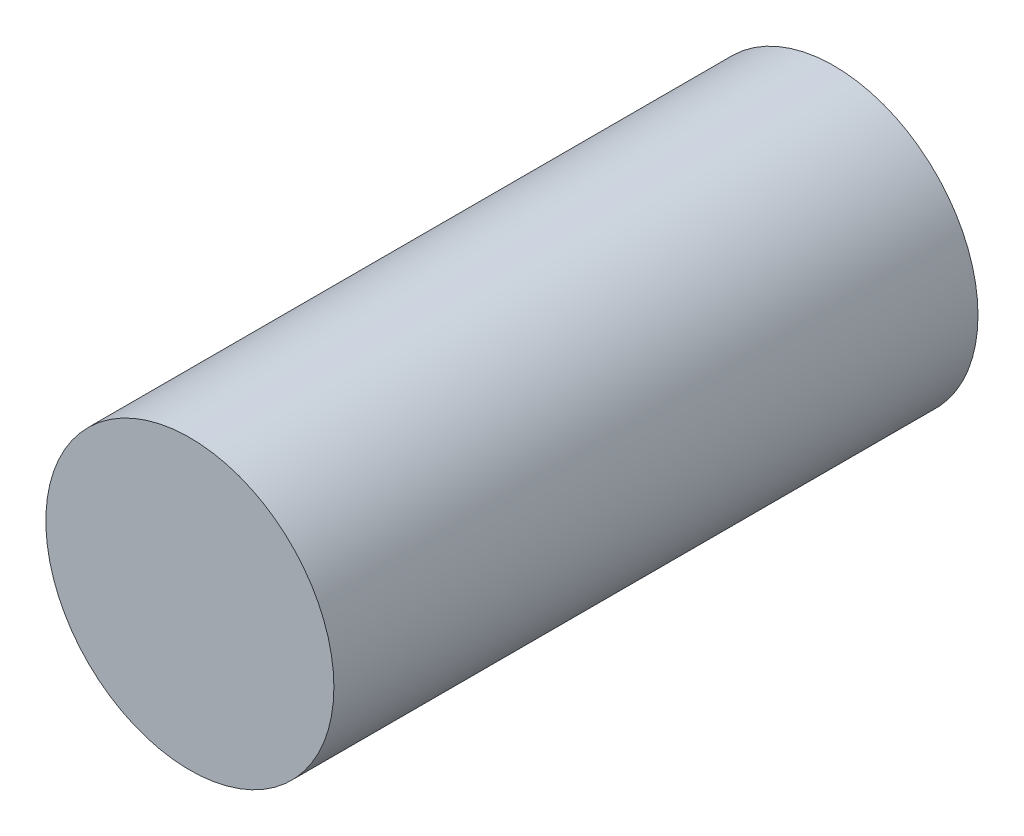
from build123d import *

# Parameters (mm, degrees)
SKETCH1_R           = 18
BOSS_EXTRUDE1_DEPTH = 80.5
SKETCH3_R           = 6
BOSS_EXTRUDE2_DEPTH = 6.8


with BuildPart() as part:
    # Sketch1 → Boss-Extrude1 (new body)
    with BuildSketch(Plane.XY):
        Circle(SKETCH1_R)
    extrude(amount=BOSS_EXTRUDE1_DEPTH)

    # Sketch3 → Boss-Extrude2 (add)
    with BuildSketch(Plane(origin=(0, 0, 0), x_dir=(-1, 0, 0), z_dir=(0, 0, -1))):
        with Locations(Location((0, -8.767148545, 0), (0, 0, 180))):
            Circle(SKETCH3_R)
    extrude(amount=BOSS_EXTRUDE2_DEPTH)


solid = part.part
